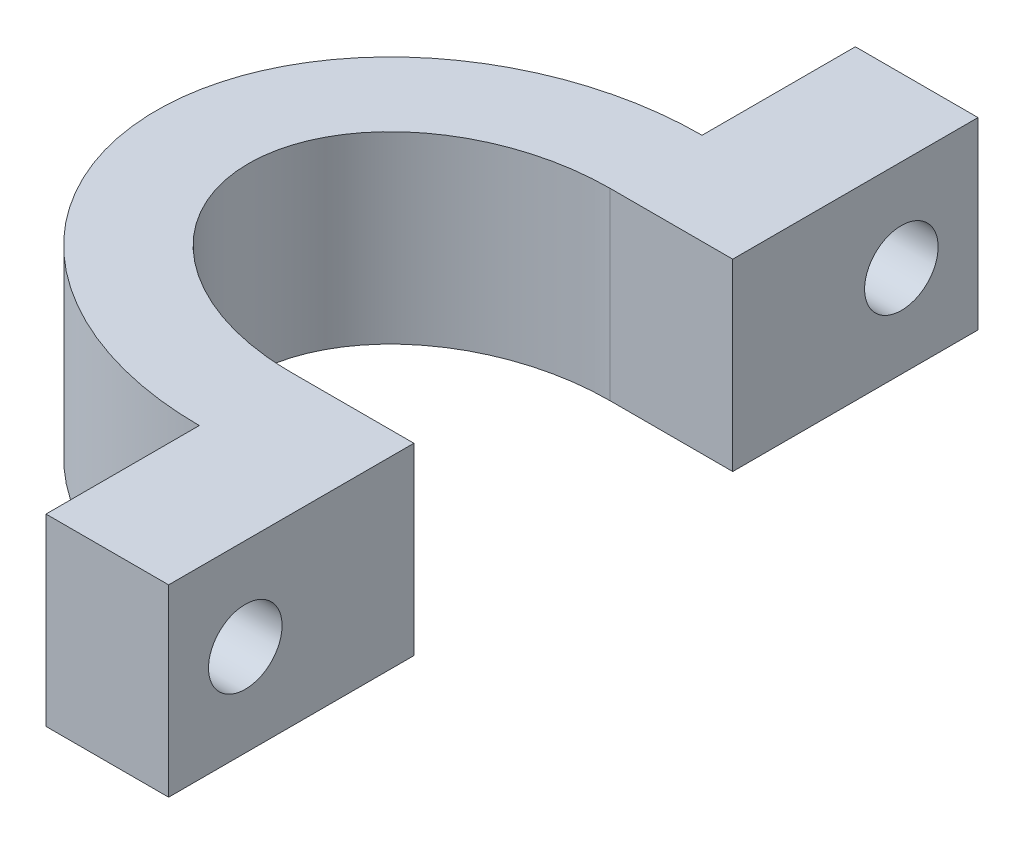
from build123d import *

# Parameters (mm, degrees)
BOSS_EXTRUDE1_DEPTH = 15
SKETCH2_W           = 20
SKETCH2_H           = 15
BOSS_EXTRUDE2_DEPTH = 10
SKETCH3_R           = 3
CUT_EXTRUDE1_DEPTH  = 44.474130404


with BuildPart() as part:
    # Sketch1 → Boss-Extrude1 (new body)
    with BuildSketch(Plane(origin=(0, 0, 0), x_dir=(1, 0, 0), z_dir=(0, 1, 0))):
        with BuildLine():
            Line((0, 13), (0, 20.5))
            add(Edge.make_bspline(
                [(0, 20.5), (-24, 20.5), (-24, 0), (-24, -20.5), (0, -20.5)],
                knots=[1.570796327, 1.570796327, 1.570796327, 3.141592654, 3.141592654, 4.71238898, 4.71238898, 4.71238898], degree=2, weights=[1, 0.707106781, 1, 0.707106781, 1]))
            Line((0, -20.5), (0, -13))
            add(Edge.make_bspline(
                [(0, 13), (-16.5, 13), (-16.5, 0), (-16.5, -13), (0, -13)],
                knots=[1.570796327, 1.570796327, 1.570796327, 3.141592654, 3.141592654, 4.71238898, 4.71238898, 4.71238898], degree=2, weights=[1, 0.707106781, 1, 0.707106781, 1]))
        make_face()
    extrude(amount=BOSS_EXTRUDE1_DEPTH)

    # Sketch2 → Boss-Extrude2 (add)
    with BuildSketch(Plane(origin=(0, 0, 0), x_dir=(0, 0, -1), z_dir=(1, 0, 0))):
        with Locations((23, 7.5)):
            Rectangle(SKETCH2_W, SKETCH2_H)
        with Locations((-23, 7.5)):
            Rectangle(SKETCH2_W, SKETCH2_H)
    extrude(amount=BOSS_EXTRUDE2_DEPTH)

    # Sketch3 → Cut-Extrude1 (cut, through all)
    with BuildSketch(Plane.ZY):
        with Locations((-26.75, 7.5)):
            Circle(SKETCH3_R)
        with Locations(Location((26.75, 7.5, 0), (0, 0, 180))):
            Circle(SKETCH3_R)
    extrude(amount=-CUT_EXTRUDE1_DEPTH, mode=Mode.SUBTRACT)


solid = part.part
